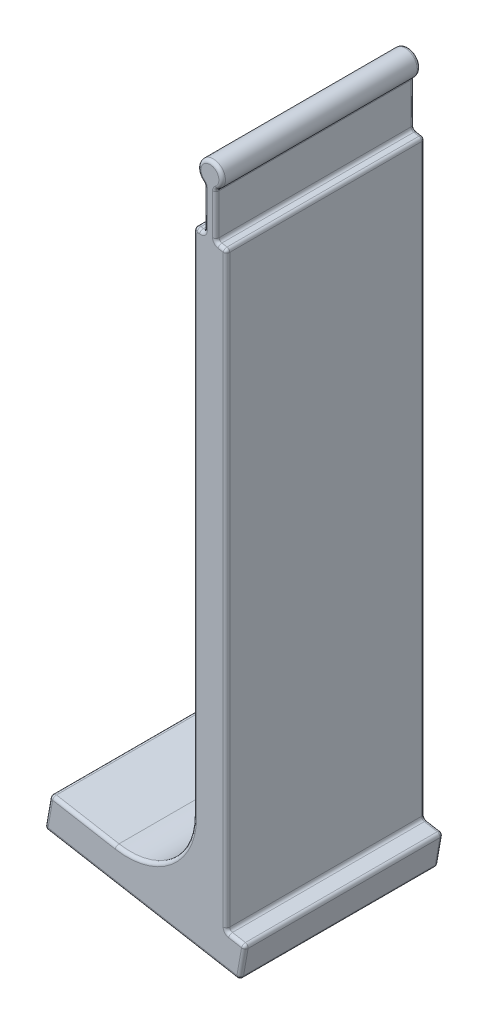
from build123d import *

# Parameters (mm, degrees)
SALIENTE_EXTRUIR1_DEPTH = 30
REDONDEO1_R             = 10
REDONDEO2_R             = 0.5


with BuildPart() as part:
    # Croquis1 → Saliente-Extruir1 (new body)
    with BuildSketch(Plane.XY):
        with BuildLine():
            ThreePointArc((0.9, -1.616322988), (0, 1.85), (-0.9, -1.616322988))
            Line((-0.9, -1.616322988), (-0.9, -8.125879105))
            Line((-0.9, -8.125879105), (-2.349231552, -7.870340482))
            Line((-2.349231552, -7.870340482), (-2.5, -8.72539084))
            Line((-2.5, -8.72539084), (-2.5, -97.020616019))
            Line((-2.5, -97.020616019), (-24.186073381, -93.196776176))
            Line((-24.186073381, -93.196776176), (-25.054314269, -98.120814941))
            Line((-25.054314269, -98.120814941), (4.489918321, -103.330260271))
            Line((4.489918321, -103.330260271), (5.358159209, -98.406221506))
            Line((5.358159209, -98.406221506), (2.5, -97.902250922))
            Line((2.5, -97.902250922), (2.5, -8.72539084))
            Line((2.5, -8.72539084), (0.9, -8.443267671))
            Line((0.9, -8.443267671), (0.9, -1.616322988))
        make_face()
    extrude(amount=SALIENTE_EXTRUIR1_DEPTH)

    # Redondeo1
    redondeo1_edges = [part.edges().sort_by_distance(p)[0] for p in [
        (-2.5, -97.020616019, 15),
    ]]
    fillet(redondeo1_edges, radius=REDONDEO1_R)

    # Redondeo2
    redondeo2_edges = [part.edges().sort_by_distance(p)[0] for p in [
        (-0.9, -4.871101047, 30),
        (-1.624615776, -7.998109794, 30),
        (0.9, -5.029795329, 0),
        (1.7, -8.584329255, 0),
        (2.5, -53.313820881, 0),
        (3.929079605, -98.154236214, 0),
        (4.924038765, -100.868240888, 0),
        (-10.282197974, -100.725537606, 0),
        (-24.620193825, -95.658795558, 0),
        (-2.5, -46.914235466, 0),
        (-2.424615776, -8.297865661, 0),
        (-1.624615776, -7.998109794, 0),
        (-0.9, -4.871101047, 0),
        (0, 1.85, 0),
        (-2.424615776, -8.297865661, 30),
        (0.9, -1.616322988, 15),
        (0.9, -8.443267671, 15),
        (2.5, -8.72539084, 15),
        (2.5, -97.902250922, 15),
        (5.358159209, -98.406221506, 15),
        (4.489918321, -103.330260271, 15),
        (-25.054314269, -98.120814941, 15),
        (-24.186073381, -93.196776176, 15),
        (-2.5, -46.914235466, 30),
        (-2.5, -8.72539084, 15),
        (-2.349231552, -7.870340482, 15),
        (-0.9, -8.125879105, 15),
        (-0.9, -1.616322988, 15),
        (-24.620193825, -95.658795558, 30),
        (-10.282197974, -100.725537606, 30),
        (-19.211277579, -94.073966899, 0),
        (-19.211277579, -94.073966899, 30),
        (-6.072123903, -92.763524524, 0),
        (-6.072123903, -92.763524524, 30),
        (0, 1.85, 30),
        (4.924038765, -100.868240888, 30),
        (3.929079605, -98.154236214, 30),
        (2.5, -53.313820881, 30),
        (1.7, -8.584329255, 30),
        (0.9, -5.029795329, 30),
    ]]
    fillet(redondeo2_edges, radius=REDONDEO2_R)


solid = part.part
